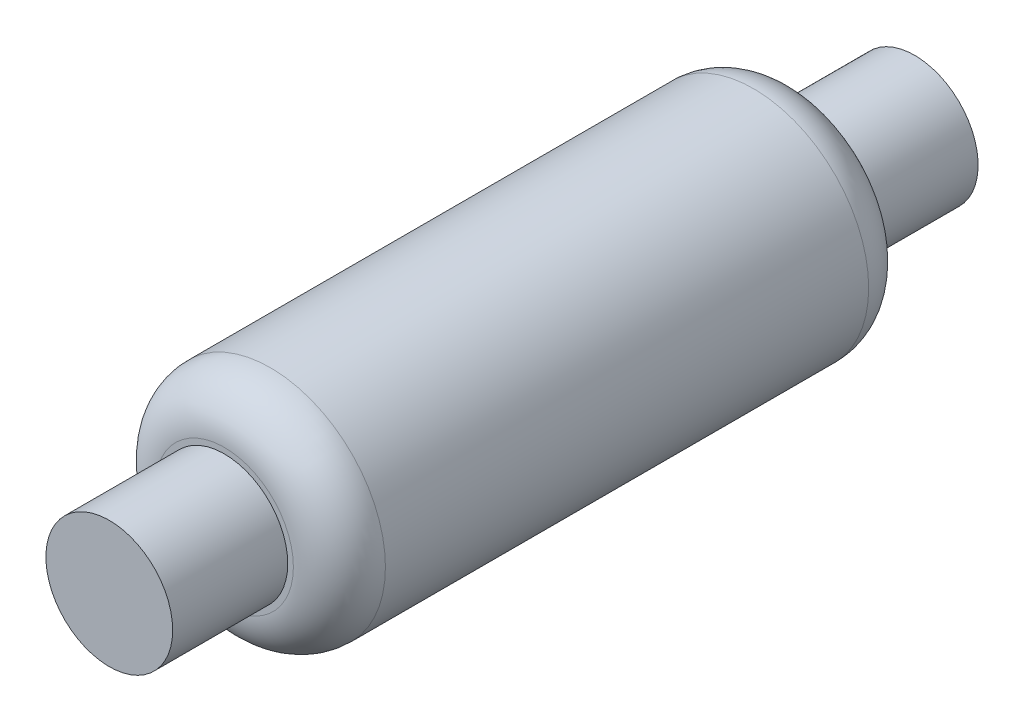
from build123d import *

# Parameters (mm, degrees)
ESQUISSE1_R        = 5
BOSS_EXTRU_1_DEPTH = 25
ESQUISSE2_R        = 2.755
BOSS_EXTRU_2_DEPTH = 5
BOSS_EXTRU_3_START = 5
ESQUISSE3_R        = 2.755
BOSS_EXTRU_3_DEPTH = 5
CONG_2_R           = 2
CONG_3_R           = 2


with BuildPart() as part:
    # Esquisse1 → Boss.-Extru.1 (new body)
    with BuildSketch(Plane.XY):
        Circle(ESQUISSE1_R)
    extrude(amount=BOSS_EXTRU_1_DEPTH)

    # Esquisse2 → Boss.-Extru.2 (add)
    with BuildSketch(Plane.XY.offset(25)):
        Circle(ESQUISSE2_R)
    extrude(amount=BOSS_EXTRU_2_DEPTH)

    # Esquisse3 → Boss.-Extru.3 (add)
    with BuildSketch(Plane(origin=(0, 0, 0), x_dir=(-1, 0, 0), z_dir=(0, 0, -1)).offset(BOSS_EXTRU_3_START)):
        with Locations(Location((0, 0, 0), (0, 0, 180))):
            Circle(ESQUISSE3_R)
    extrude(amount=-BOSS_EXTRU_3_DEPTH)

    # Congé2
    cong_2_edges = [part.edges().sort_by_distance(p)[0] for p in [
        (-5, 0, 0),
    ]]
    fillet(cong_2_edges, radius=CONG_2_R)

    # Congé3
    cong_3_edges = [part.edges().sort_by_distance(p)[0] for p in [
        (-5, 0, 25),
    ]]
    fillet(cong_3_edges, radius=CONG_3_R)


solid = part.part
